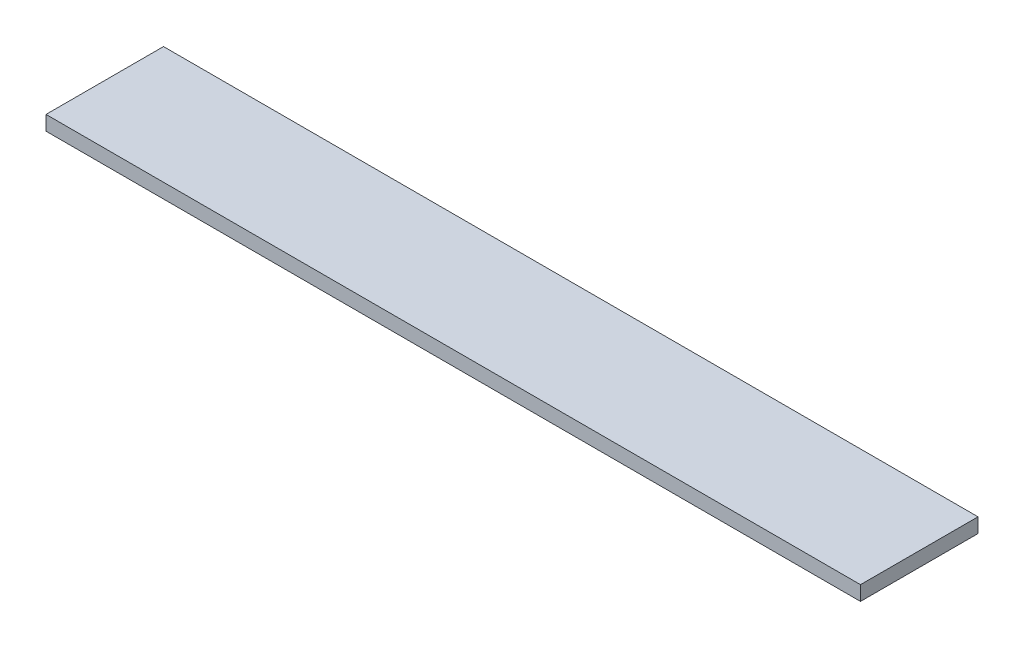
from build123d import *

# Parameters (mm, degrees)
SKETCH1_W           = 177.8
SKETCH1_H           = 3.175
BOSS_EXTRUDE1_DEPTH = 25.654


with BuildPart() as part:
    # Sketch1 → Boss-Extrude1 (new body)
    with BuildSketch(Plane.XY):
        with Locations((88.9, -1.5875)):
            Rectangle(SKETCH1_W, SKETCH1_H)
    extrude(amount=BOSS_EXTRUDE1_DEPTH)


solid = part.part
